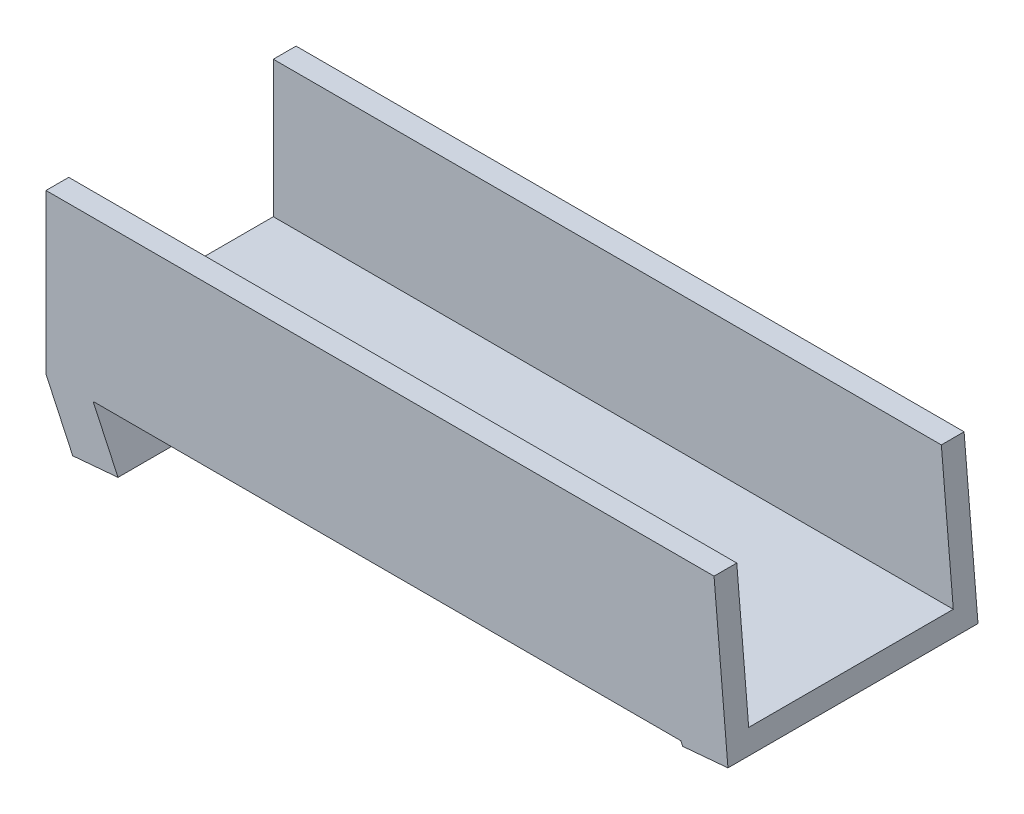
from build123d import *

# Parameters (mm, degrees)
ESQUISSE2_W             = 150
ESQUISSE2_H             = 55
BOSS_EXTRU_1_DEPTH      = 5
ESQUISSE3_W             = 150
ESQUISSE3_H             = 5
BOSS_EXTRU_2_DEPTH      = 30
BOSS_EXTRU_3_DEPTH      = 55
ENL_V_MAT_EXTRU_1_DEPTH = 164.554272338


with BuildPart() as part:
    # Esquisse2 → Boss.-Extru.1 (new body)
    with BuildSketch(Plane(origin=(0, 0, 0), x_dir=(1, 0, 0), z_dir=(0, 1, 0))):
        with Locations((75, 27.5)):
            Rectangle(ESQUISSE2_W, ESQUISSE2_H)
    extrude(amount=BOSS_EXTRU_1_DEPTH)

    # Esquisse3 → Boss.-Extru.2 (add)
    with BuildSketch(Plane(origin=(0, 5, 0), x_dir=(1, 0, 0), z_dir=(0, 1, 0))):
        with Locations((75, 2.5)):
            Rectangle(ESQUISSE3_W, ESQUISSE3_H)
        with Locations((75, 52.5)):
            Rectangle(ESQUISSE3_W, ESQUISSE3_H)
    extrude(amount=BOSS_EXTRU_2_DEPTH)

    # Esquisse4 → Boss.-Extru.3 (add)
    with BuildSketch(Plane.XY):
        Polygon((0, 0), (5.879626117, -12.608898898), (15.841573098, -11.73734147), (10.368360884, 0), align=None)
        Polygon((150, 0), (140.038053019, -0.871557427), (139.631639116, 0), align=None)
    extrude(amount=-BOSS_EXTRU_3_DEPTH)

    # Esquisse5 → Enlèv. mat.-Extru.1 (cut, through all)
    with BuildSketch(Plane.XY):
        Polygon((150, 0), (146.937896777, 35), (150, 35), align=None)
    extrude(amount=-ENL_V_MAT_EXTRU_1_DEPTH, mode=Mode.SUBTRACT)


solid = part.part
